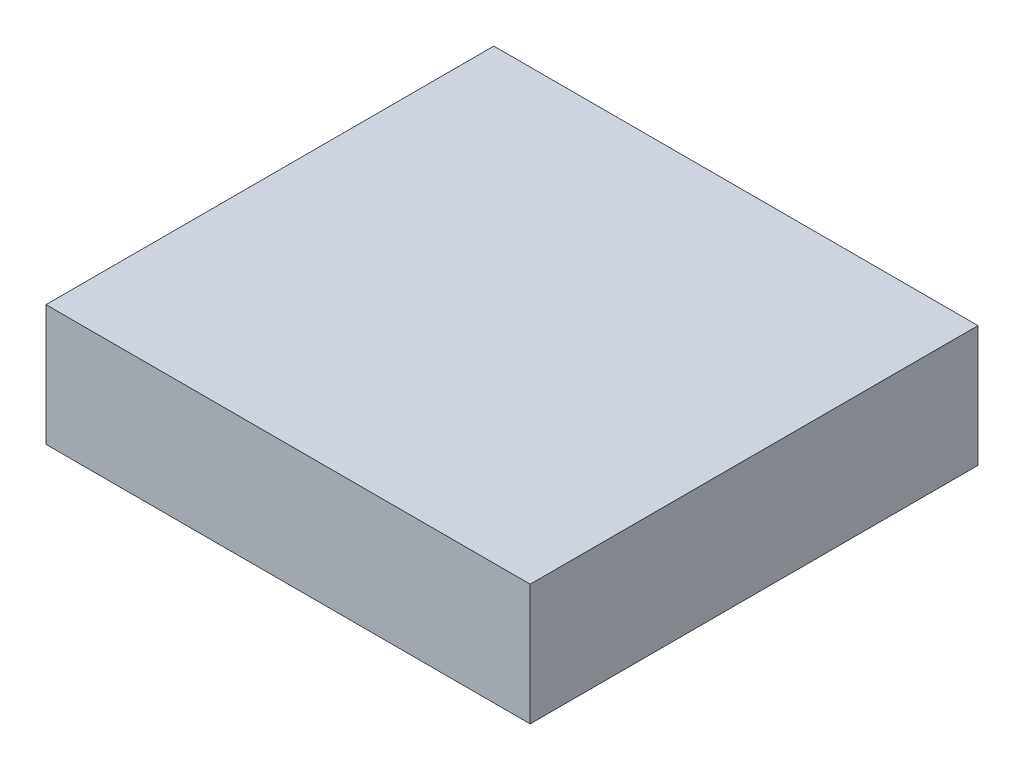
from build123d import *

# Parameters (mm, degrees)
SKETCH1_W           = 40
SKETCH1_H           = 37
BOSS_EXTRUDE1_DEPTH = 10


with BuildPart() as part:
    # Sketch1 → Boss-Extrude1 (new body)
    with BuildSketch(Plane(origin=(0, 0, 0), x_dir=(1, 0, 0), z_dir=(0, 1, 0))):
        with Locations((20, 18.5)):
            Rectangle(SKETCH1_W, SKETCH1_H)
    extrude(amount=BOSS_EXTRUDE1_DEPTH)


solid = part.part
